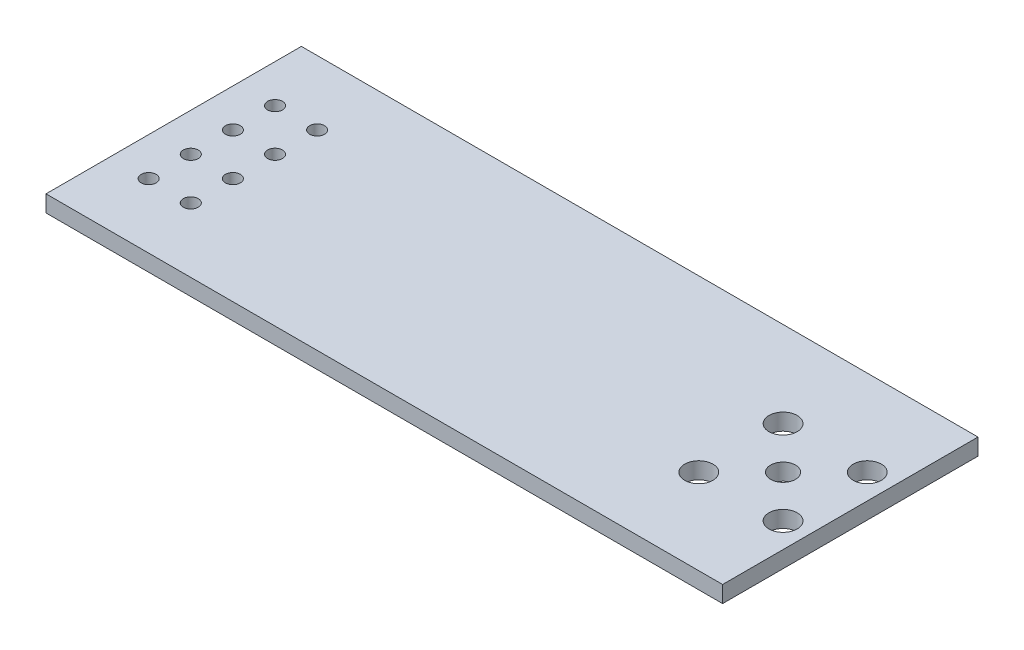
from build123d import *

# Parameters (mm, degrees)
SKETCH_1_W      = 40.8
SKETCH_1_H      = 15.4
SKETCH_1_R      = 0.45
SKETCH_1_R_2    = 0.85
SKETCH_1_R_3    = 0.75
EXTRUDE_1_DEPTH = 1


with BuildPart() as part:
    # Эскиз1 → Бобышка-Вытянуть1 (new body)
    with BuildSketch(Plane(origin=(0, 0, 0), x_dir=(1, 0, 0), z_dir=(0, 1, 0))):
        with Locations((20.4, 7.7)):
            Rectangle(SKETCH_1_W, SKETCH_1_H)
        with Locations(Location((2.299992341, 3.89, 0), (0, 0, 270))):
            Circle(SKETCH_1_R, mode=Mode.SUBTRACT)
        with Locations(Location((2.299993928, 6.43, 0), (0, 0, 270))):
            Circle(SKETCH_1_R, mode=Mode.SUBTRACT)
        with Locations(Location((2.299995515, 8.97, 0), (0, 0, 270))):
            Circle(SKETCH_1_R, mode=Mode.SUBTRACT)
        with Locations(Location((2.3, 11.51, 0), (0, 0, 270))):
            Circle(SKETCH_1_R, mode=Mode.SUBTRACT)
        with Locations(Location((4.839992341, 3.89, 0), (0, 0, 270))):
            Circle(SKETCH_1_R, mode=Mode.SUBTRACT)
        with Locations(Location((4.839992341, 6.43, 0), (0, 0, 270))):
            Circle(SKETCH_1_R, mode=Mode.SUBTRACT)
        with Locations(Location((4.839992341, 8.97, 0), (0, 0, 270))):
            Circle(SKETCH_1_R, mode=Mode.SUBTRACT)
        with Locations(Location((4.839992341, 11.51, 0), (0, 0, 270))):
            Circle(SKETCH_1_R, mode=Mode.SUBTRACT)
        with Locations(Location((34.22, 5.144366898, 0), (0, 0, 270))):
            Circle(SKETCH_1_R_2, mode=Mode.SUBTRACT)
        with Locations(Location((34.22, 10.224366898, 0), (0, 0, 270))):
            Circle(SKETCH_1_R_2, mode=Mode.SUBTRACT)
        with Locations(Location((39.3, 5.144366898, 0), (0, 0, 270))):
            Circle(SKETCH_1_R_2, mode=Mode.SUBTRACT)
        with Locations(Location((39.3, 10.224366898, 0), (0, 0, 270))):
            Circle(SKETCH_1_R_2, mode=Mode.SUBTRACT)
        with Locations(Location((36.76, 7.684366898, 0), (0, 0, 270))):
            Circle(SKETCH_1_R_3, mode=Mode.SUBTRACT)
    extrude(amount=EXTRUDE_1_DEPTH)


solid = part.part
